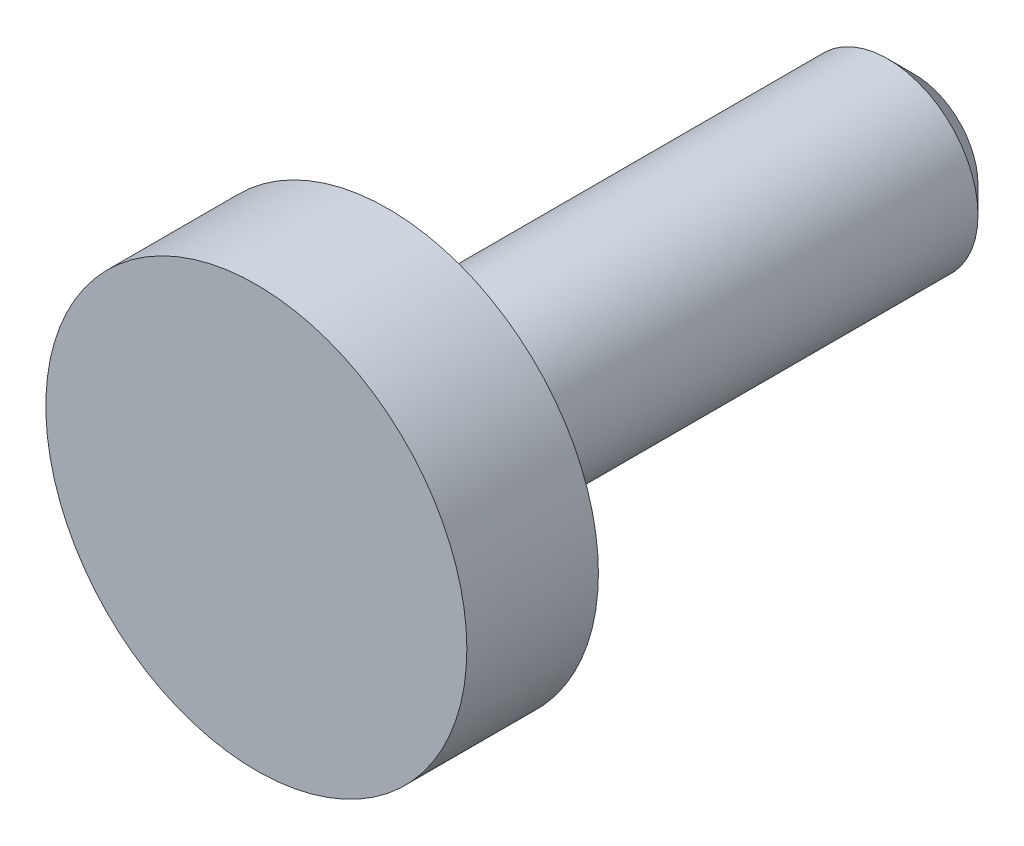
from build123d import *

# Parameters (mm, degrees)
SKETCH1_R           = 3.425
BOSS_EXTRUDE1_DEPTH = 20
SKETCH2_R           = 8
BOSS_EXTRUDE3_DEPTH = 5
CHAMFER1_SIZE       = 1


with BuildPart() as part:
    # Sketch1 → Boss-Extrude1 (new body)
    with BuildSketch(Plane.XY):
        Circle(SKETCH1_R)
    extrude(amount=BOSS_EXTRUDE1_DEPTH)

    # Sketch2 → Boss-Extrude3 (add)
    with BuildSketch(Plane.XY.offset(20)):
        Circle(SKETCH2_R)
    extrude(amount=BOSS_EXTRUDE3_DEPTH)

    # Chamfer1
    chamfer1_edges = [part.edges().sort_by_distance(p)[0] for p in [
        (-3.425, 0, 0),
    ]]
    chamfer(chamfer1_edges, length=CHAMFER1_SIZE)


solid = part.part
